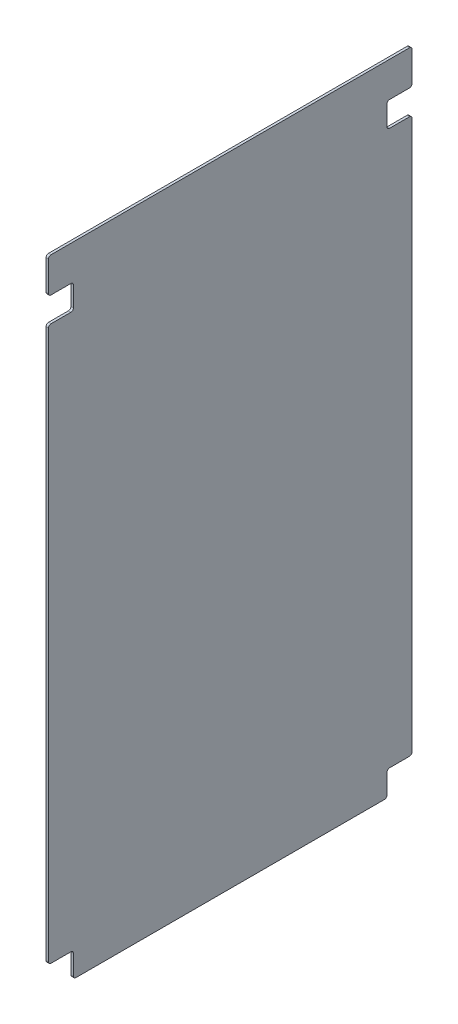
from build123d import *

# Parameters (mm, degrees)
SKETCH1_W           = 463.55
SKETCH1_H           = 814.3875
BOSS_EXTRUDE1_DEPTH = 3.175
FILLET1_R           = 3.175
CUT_EXTRUDE2_REACH  = 939.078
SKETCH3_W           = 31.75
SKETCH3_H           = 31.75
FILLET2_R           = 3.175
FILLET3_R           = 3.175
FILLET4_R           = 3.175


with BuildPart() as part:
    # Sketch1 → Boss-Extrude1 (new body)
    with BuildSketch(Plane(origin=(0, 0, 0), x_dir=(0, 0, -1), z_dir=(1, 0, 0))):
        with Locations((231.775, 407.19375)):
            Rectangle(SKETCH1_W, SKETCH1_H)
    extrude(amount=BOSS_EXTRUDE1_DEPTH)

    # Fillet1
    fillet1_edges = [part.edges().sort_by_distance(p)[0] for p in [
        (1.5875, 814.3875, 0),
        (1.5875, 814.3875, -463.55),
        (1.5875, 0, -463.55),
        (1.5875, 0, 0),
    ]]
    fillet(fillet1_edges, radius=FILLET1_R)

    # Sketch3 → Cut-Extrude2 (cut, up to next)
    with BuildSketch(Plane(origin=(3.175, 0, 0), x_dir=(0, 0, -1), z_dir=(1, 0, 0)), mode=Mode.PRIVATE) as cut_extrude2_sk1:
        with Locations((15.875, 754.0625)):
            Rectangle(SKETCH3_W, SKETCH3_H)
    cut_extrude2_tool1 = extrude(cut_extrude2_sk1.sketch, amount=-CUT_EXTRUDE2_REACH, mode=Mode.PRIVATE) & part.part
    # Sketch3 → Cut-Extrude2 (cut, up to next)
    with BuildSketch(Plane(origin=(3.175, 0, 0), x_dir=(0, 0, -1), z_dir=(1, 0, 0)), mode=Mode.PRIVATE) as cut_extrude2_sk2:
        with Locations((447.675, 754.0625)):
            Rectangle(SKETCH3_W, SKETCH3_H)
    cut_extrude2_tool2 = extrude(cut_extrude2_sk2.sketch, amount=-CUT_EXTRUDE2_REACH, mode=Mode.PRIVATE) & part.part
    # Sketch3 → Cut-Extrude2 (cut, up to next)
    with BuildSketch(Plane(origin=(3.175, 0, 0), x_dir=(0, 0, -1), z_dir=(1, 0, 0)), mode=Mode.PRIVATE) as cut_extrude2_sk3:
        with Locations((447.675, 15.875)):
            Rectangle(SKETCH3_W, SKETCH3_H)
    cut_extrude2_tool3 = extrude(cut_extrude2_sk3.sketch, amount=-CUT_EXTRUDE2_REACH, mode=Mode.PRIVATE) & part.part
    # Sketch3 → Cut-Extrude2 (cut, up to next)
    with BuildSketch(Plane(origin=(3.175, 0, 0), x_dir=(0, 0, -1), z_dir=(1, 0, 0)), mode=Mode.PRIVATE) as cut_extrude2_sk4:
        with Locations((15.875, 15.875)):
            Rectangle(SKETCH3_W, SKETCH3_H)
    cut_extrude2_tool4 = extrude(cut_extrude2_sk4.sketch, amount=-CUT_EXTRUDE2_REACH, mode=Mode.PRIVATE) & part.part
    add(cut_extrude2_tool1.solids().sort_by_distance((3.175, 754.0625, -15.875))[0], mode=Mode.SUBTRACT)
    add(cut_extrude2_tool2.solids().sort_by_distance((3.175, 754.0625, -447.675))[0], mode=Mode.SUBTRACT)
    add(cut_extrude2_tool3.solids().sort_by_distance((3.175, 15.875, -447.675))[0], mode=Mode.SUBTRACT)
    add(cut_extrude2_tool4.solids().sort_by_distance((3.175, 15.875, -15.875))[0], mode=Mode.SUBTRACT)

    # Fillet2
    fillet2_edges = [part.edges().sort_by_distance(p)[0] for p in [
        (1.5875, 738.1875, 0),
        (1.5875, 769.9375, 0),
        (1.5875, 769.9375, -31.75),
        (1.5875, 738.1875, -31.75),
    ]]
    fillet(fillet2_edges, radius=FILLET2_R)

    # Fillet3
    fillet3_edges = [part.edges().sort_by_distance(p)[0] for p in [
        (1.5875, 769.9375, -431.8),
        (1.5875, 769.9375, -463.55),
        (1.5875, 738.1875, -463.55),
        (1.5875, 738.1875, -431.8),
    ]]
    fillet(fillet3_edges, radius=FILLET3_R)

    # Fillet4
    fillet4_edges = [part.edges().sort_by_distance(p)[0] for p in [
        (1.5875, 31.75, 0),
        (1.5875, 31.75, -31.75),
        (1.5875, 0, -31.75),
        (1.5875, 0, -431.8),
        (1.5875, 31.75, -431.8),
        (1.5875, 31.75, -463.55),
    ]]
    fillet(fillet4_edges, radius=FILLET4_R)


solid = part.part
